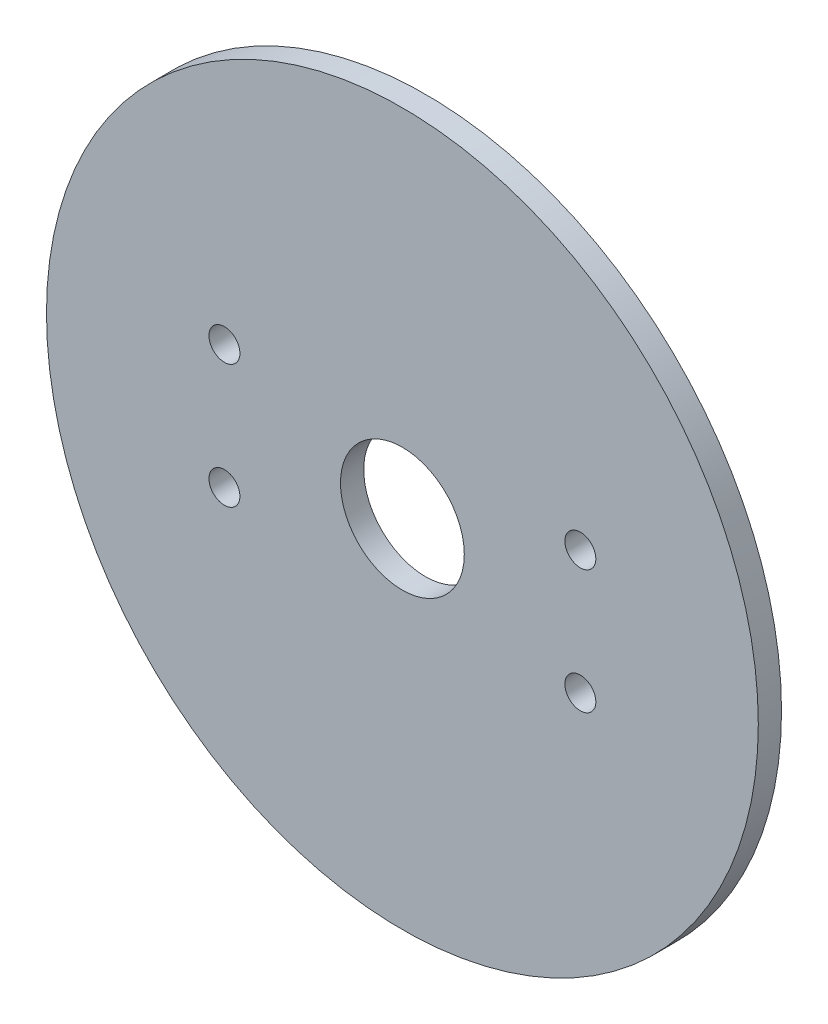
from build123d import *

# Parameters (mm, degrees)
SKETCH_1_R          = 46
EXTRUDE_1_DEPTH     = 3
SKETCH_2_R          = 8
CUT_EXTRUDE_1_DEPTH = 3
SKETCH_3_R          = 2
CUT_EXTRUDE_2_DEPTH = 3


with BuildPart() as part:
    # 스케치1 → 보스-돌출1 (new body)
    with BuildSketch(Plane.XY):
        Circle(SKETCH_1_R)
    extrude(amount=EXTRUDE_1_DEPTH)

    # 스케치2 → 컷-돌출1 (cut)
    with BuildSketch(Plane.XY.offset(3)):
        Circle(SKETCH_2_R)
    extrude(amount=-CUT_EXTRUDE_1_DEPTH, mode=Mode.SUBTRACT)

    # 스케치3 → 컷-돌출2 (cut)
    with BuildSketch(Plane.XY.offset(3)):
        with Locations((-23, 8)):
            Circle(SKETCH_3_R)
        with Locations(Location((-23, -8, 0), (0, 0, 180))):
            Circle(SKETCH_3_R)
        with Locations((23, -8)):
            Circle(SKETCH_3_R)
        with Locations(Location((23, 8, 0), (0, 0, 180))):
            Circle(SKETCH_3_R)
    extrude(amount=-CUT_EXTRUDE_2_DEPTH, mode=Mode.SUBTRACT)


solid = part.part
